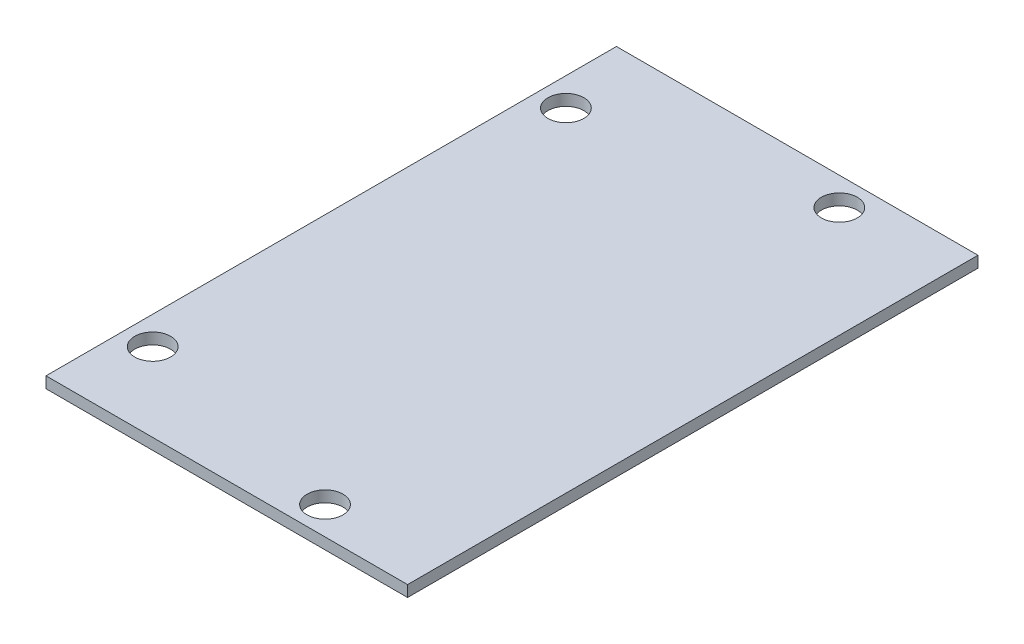
from build123d import *

# Parameters (mm, degrees)
ESQUISSE1_W      = 32.2
ESQUISSE1_H      = 50.8
ESQUISSE1_R      = 1.6
EXTRUSION1_DEPTH = 1


with BuildPart() as part:
    # Esquisse1 → Extrusion1 (new body)
    with BuildSketch(Plane(origin=(0, 0, 0), x_dir=(1, 0, 0), z_dir=(0, 1, 0))):
        with Locations((-6.25, -10.4)):
            Rectangle(ESQUISSE1_W, ESQUISSE1_H)
        with Locations(Location((0, -33.3, 0), (0, 0, 270))):
            Circle(ESQUISSE1_R, mode=Mode.SUBTRACT)
        with Locations(Location((0, 12.5, 0), (0, 0, 270))):
            Circle(ESQUISSE1_R, mode=Mode.SUBTRACT)
        with Locations(Location((-19.85, 8, 0), (0, 0, 270))):
            Circle(ESQUISSE1_R, mode=Mode.SUBTRACT)
        with Locations(Location((-19.85, -28.8, 0), (0, 0, 270))):
            Circle(ESQUISSE1_R, mode=Mode.SUBTRACT)
    extrude(amount=EXTRUSION1_DEPTH)


solid = part.part
